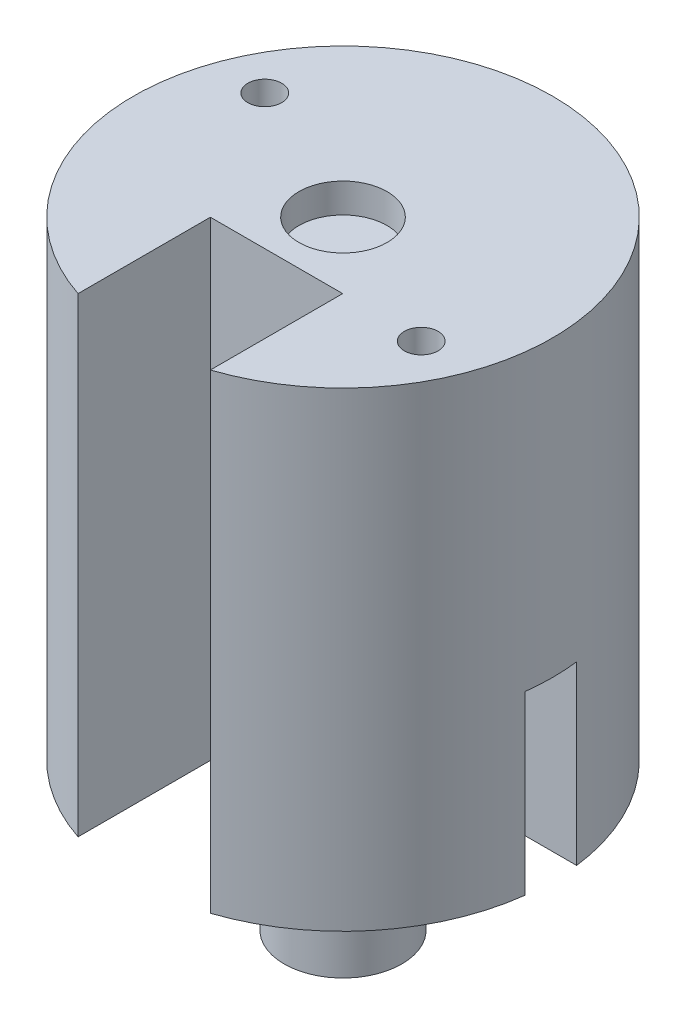
from build123d import *

# Parameters (mm, degrees)
SKETCH_1_R          = 14.25
EXTRUDE_1_DEPTH     = 32
SKETCH_3_R          = 1.215
CUT_EXTRUDE_1_DEPTH = 30
SKETCH_4_R          = 4
EXTRUDE_2_DEPTH     = 10
CUT_EXTRUDE_2_DEPTH = 10
CHAMFER_1_SIZE      = 1
CUT_EXTRUDE_3_DEPTH = 47.58460046
SKETCH_7_R          = 1.15
CUT_EXTRUDE_4_DEPTH = 47.58460046
SKETCH_8_R          = 3
CUT_EXTRUDE_5_DEPTH = 2
SKETCH_9_R          = 1.215
CUT_EXTRUDE_6_DEPTH = 12
SKETCH_10_R         = 2.05
CUT_EXTRUDE_7_DEPTH = 29


with BuildPart() as part:
    # 草图1 → 凸台-拉伸1 (new body)
    with BuildSketch(Plane(origin=(0, 0, 0), x_dir=(1, 0, 0), z_dir=(0, 1, 0))):
        Circle(SKETCH_1_R)
    extrude(amount=EXTRUDE_1_DEPTH)

    # 草图3 → 切除-拉伸1 (cut)
    with BuildSketch(Plane.XZ):
        with Locations((10.5, 0)):
            Circle(SKETCH_3_R)
        with Locations((-10.5, 0)):
            Circle(SKETCH_3_R)
    extrude(amount=-CUT_EXTRUDE_1_DEPTH, mode=Mode.SUBTRACT)

    # 草图4 → 凸台-拉伸2 (add)
    with BuildSketch(Plane.XZ):
        Circle(SKETCH_4_R)
    extrude(amount=EXTRUDE_2_DEPTH)

    # 草图5 → 切除-拉伸2 (cut)
    with BuildSketch(Plane.XZ.offset(10)):
        Polygon((0, -2.932939367), (2.54, -1.466469684), (2.54, 1.466469684), (0, 2.932939367), (-2.54, 1.466469684), (-2.54, -1.466469684), align=None)
    extrude(amount=-CUT_EXTRUDE_2_DEPTH, mode=Mode.SUBTRACT)

    # 倒角1
    chamfer_1_edges = [part.edges().sort_by_distance(p)[0] for p in [
        (-4, 0, 0),
    ]]
    chamfer(chamfer_1_edges, length=CHAMFER_1_SIZE)

    # 草图6 → 切除-拉伸3 (cut, through all)
    with BuildSketch(Plane(origin=(0, 32, 0), x_dir=(1, 0, 0), z_dir=(0, 1, 0))):
        with BuildLine():
            Line((4.5, -4.520817283), (-4.5, -4.520817283))
            Line((-4.5, -4.520817283), (-4.5, -13.520817283))
            ThreePointArc((-4.5, -13.520817283), (0, -14.25), (4.5, -13.520817283))
            Line((4.5, -13.520817283), (4.5, -4.520817283))
        make_face()
    extrude(amount=-CUT_EXTRUDE_3_DEPTH, mode=Mode.SUBTRACT)

    # 草图7 → 切除-拉伸4 (cut, through all)
    with BuildSketch(Plane(origin=(0, 32, 0), x_dir=(1, 0, 0), z_dir=(0, 1, 0))):
        with Locations((-9.969385657, 4.648800879)):
            Circle(SKETCH_7_R)
        with Locations((9.969385657, -4.648800879)):
            Circle(SKETCH_7_R)
    extrude(amount=-CUT_EXTRUDE_4_DEPTH, mode=Mode.SUBTRACT)

    # 草图8 → 切除-拉伸5 (cut)
    with BuildSketch(Plane(origin=(0, 32, 0), x_dir=(1, 0, 0), z_dir=(0, 1, 0))):
        Circle(SKETCH_8_R)
    extrude(amount=-CUT_EXTRUDE_5_DEPTH, mode=Mode.SUBTRACT)

    # 草图9 → 切除-拉伸6 (cut)
    # profile 1 of 2: a face of its own
    with BuildSketch(Plane.XZ):
        with BuildLine():
            ThreePointArc((-14.142135624, 1.75), (-14.25, 0), (-14.142135624, -1.75))
            Line((-14.142135624, -1.75), (-10.5, -1.75))
            ThreePointArc((-10.5, -1.75), (-8.75, 0), (-10.5, 1.75))
            Line((-10.5, 1.75), (-14.142135624, 1.75))
        make_face()
        with Locations((-10.5, 0)):
            Circle(SKETCH_9_R, mode=Mode.SUBTRACT)
    # profile 2 of 2: a face of its own
    with BuildSketch(Plane.XZ):
        with BuildLine():
            Line((10.5, -1.75), (14.142135624, -1.75))
            ThreePointArc((14.142135624, -1.75), (14.25, 0), (14.142135624, 1.75))
            Line((14.142135624, 1.75), (10.5, 1.75))
            ThreePointArc((10.5, 1.75), (8.75, 0), (10.5, -1.75))
        make_face()
        with Locations((10.5, 0)):
            Circle(SKETCH_9_R, mode=Mode.SUBTRACT)
    extrude(amount=-CUT_EXTRUDE_6_DEPTH, mode=Mode.SUBTRACT)

    # 草图10 → 切除-拉伸7 (cut)
    with BuildSketch(Plane.XZ):
        with Locations((-9.969385657, -4.648800879)):
            Circle(SKETCH_10_R)
        with Locations((9.969385657, 4.648800879)):
            Circle(SKETCH_10_R)
    extrude(amount=-CUT_EXTRUDE_7_DEPTH, mode=Mode.SUBTRACT)


solid = part.part
